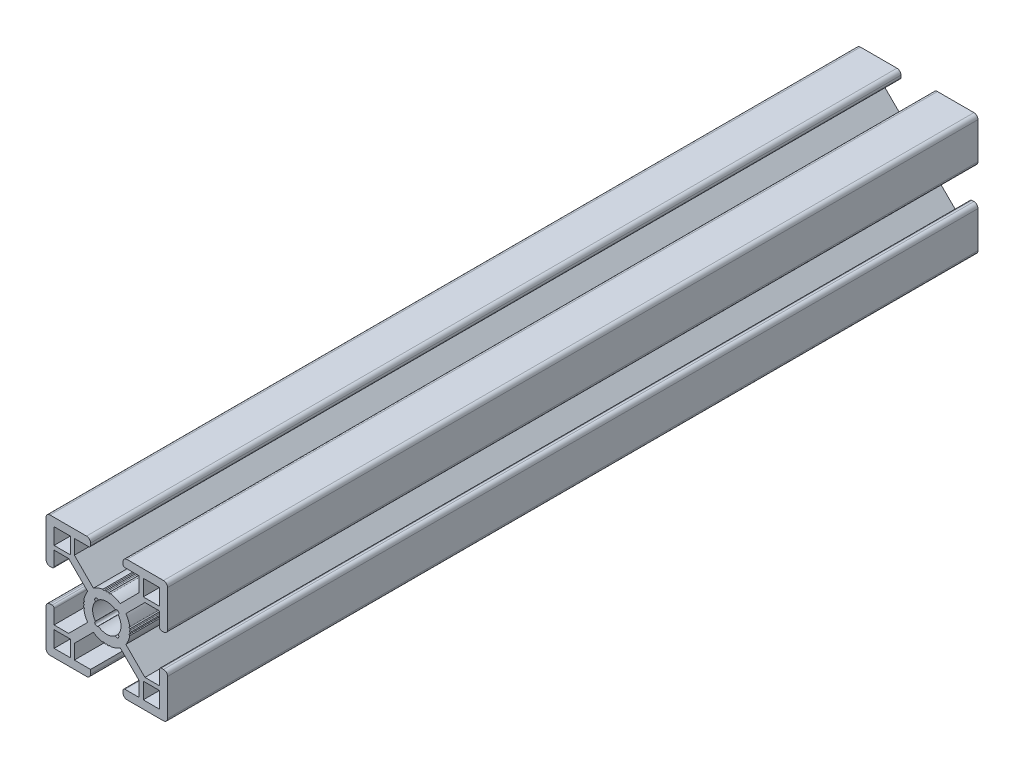
from build123d import *

# Parameters (mm, degrees)
SKETCH1_W           = 4
SKETCH1_H           = 4
BOSS_EXTRUDE1_DEPTH = 100


with BuildPart() as part:
    # Sketch1 → Boss-Extrude1 (new, symmetric)
    with BuildSketch(Plane.XY):
        with BuildLine():
            Line((-15, 14), (-15, 5))
            ThreePointArc((-15, 5), (-14.707106781, 4.292893219), (-14, 4))
            Line((-14, 4), (-13.5, 4))
            ThreePointArc((-13.5, 4), (-13.146446609, 4.146446609), (-13, 4.5))
            Line((-13, 4.5), (-13, 8))
            Line((-13, 8), (-9.414213562, 8))
            Line((-9.414213562, 8), (-4.711011126, 3.296797563))
            ThreePointArc((-4.711011126, 3.296797563), (-5.322383956, 2.17594325), (-5.671345569, 0.947807702))
            ThreePointArc((-5.671345569, 0.947807702), (-5.502585747, 0.723913043), (-5.723511591, 0.551284925))
            ThreePointArc((-5.723511591, 0.551284925), (-5.737706139, 0.375803491), (-5.746521739, 0.199969752))
            ThreePointArc((-5.746521739, 0.199969752), (-5.607354194, 0.140186212), (-5.55, 0))
            ThreePointArc((-5.55, 0), (-5.607354194, -0.140186212), (-5.746521739, -0.199969752))
            ThreePointArc((-5.746521739, -0.199969752), (-5.737706139, -0.375803491), (-5.723511591, -0.551284925))
            ThreePointArc((-5.723511591, -0.551284925), (-5.502585747, -0.723913043), (-5.671345569, -0.947807702))
            ThreePointArc((-5.671345569, -0.947807702), (-5.322383956, -2.17594325), (-4.711011126, -3.296797563))
            Line((-4.711011126, -3.296797563), (-9.414213562, -8))
            Line((-9.414213562, -8), (-13, -8))
            Line((-13, -8), (-13, -4.5))
            ThreePointArc((-13, -4.5), (-13.146446609, -4.146446609), (-13.5, -4))
            Line((-13.5, -4), (-14, -4))
            ThreePointArc((-14, -4), (-14.707106781, -4.292893219), (-15, -5))
            Line((-15, -5), (-15, -14))
            ThreePointArc((-15, -14), (-14.707106781, -14.707106781), (-14, -15))
            Line((-14, -15), (-5, -15))
            ThreePointArc((-5, -15), (-4.292893219, -14.707106781), (-4, -14))
            Line((-4, -14), (-4, -13))
            Line((-4, -13), (-8, -13))
            Line((-8, -13), (-8, -9.414213562))
            Line((-8, -9.414213562), (-3.296797563, -4.711011126))
            ThreePointArc((-3.296797563, -4.711011126), (-2.17594325, -5.322383956), (-0.947807702, -5.671345569))
            ThreePointArc((-0.947807702, -5.671345569), (-0.723913043, -5.502585747), (-0.551284925, -5.723511591))
            ThreePointArc((-0.551284925, -5.723511591), (-0.375803491, -5.737706139), (-0.199969752, -5.746521739))
            ThreePointArc((-0.199969752, -5.746521739), (-0.140186212, -5.607354194), (0, -5.55))
            ThreePointArc((0, -5.55), (0.140186212, -5.607354194), (0.199969752, -5.746521739))
            ThreePointArc((0.199969752, -5.746521739), (0.375803491, -5.737706139), (0.551284925, -5.723511591))
            ThreePointArc((0.551284925, -5.723511591), (0.723913043, -5.502585747), (0.947807702, -5.671345569))
            ThreePointArc((0.947807702, -5.671345569), (2.17594325, -5.322383956), (3.296797563, -4.711011126))
            Line((3.296797563, -4.711011126), (8, -9.414213562))
            Line((8, -9.414213562), (8, -13))
            Line((8, -13), (4.5, -13))
            ThreePointArc((4.5, -13), (4.146446609, -13.146446609), (4, -13.5))
            Line((4, -13.5), (4, -14))
            ThreePointArc((4, -14), (4.292893219, -14.707106781), (5, -15))
            Line((5, -15), (14, -15))
            ThreePointArc((14, -15), (14.707106781, -14.707106781), (15, -14))
            Line((15, -14), (15, -5))
            ThreePointArc((15, -5), (14.707106781, -4.292893219), (14, -4))
            Line((14, -4), (13.5, -4))
            ThreePointArc((13.5, -4), (13.146446609, -4.146446609), (13, -4.5))
            Line((13, -4.5), (13, -8))
            Line((13, -8), (9.414213562, -8))
            Line((9.414213562, -8), (4.711011126, -3.296797563))
            ThreePointArc((4.711011126, -3.296797563), (5.322383956, -2.17594325), (5.671345569, -0.947807702))
            ThreePointArc((5.671345569, -0.947807702), (5.502585747, -0.723913043), (5.723511591, -0.551284925))
            ThreePointArc((5.723511591, -0.551284925), (5.737706139, -0.375803491), (5.746521739, -0.199969752))
            ThreePointArc((5.746521739, -0.199969752), (5.607354194, -0.140186212), (5.55, 0))
            ThreePointArc((5.55, 0), (5.607354194, 0.140186212), (5.746521739, 0.199969752))
            ThreePointArc((5.746521739, 0.199969752), (5.737706139, 0.375803491), (5.723511591, 0.551284925))
            ThreePointArc((5.723511591, 0.551284925), (5.502585747, 0.723913043), (5.671345569, 0.947807702))
            ThreePointArc((5.671345569, 0.947807702), (5.322383956, 2.17594325), (4.711011126, 3.296797563))
            Line((4.711011126, 3.296797563), (9.414213562, 8))
            Line((9.414213562, 8), (13, 8))
            Line((13, 8), (13, 4.5))
            ThreePointArc((13, 4.5), (13.146446609, 4.146446609), (13.5, 4))
            Line((13.5, 4), (14, 4))
            ThreePointArc((14, 4), (14.707106781, 4.292893219), (15, 5))
            Line((15, 5), (15, 14))
            ThreePointArc((15, 14), (14.707106781, 14.707106781), (14, 15))
            Line((14, 15), (5, 15))
            ThreePointArc((5, 15), (4.292893219, 14.707106781), (4, 14))
            Line((4, 14), (4, 13.5))
            ThreePointArc((4, 13.5), (4.146446609, 13.146446609), (4.5, 13))
            Line((4.5, 13), (8, 13))
            Line((8, 13), (8, 9.414213562))
            Line((8, 9.414213562), (3.296797563, 4.711011126))
            ThreePointArc((3.296797563, 4.711011126), (2.17594325, 5.322383956), (0.947807702, 5.671345569))
            ThreePointArc((0.947807702, 5.671345569), (0.723913043, 5.502585747), (0.551284925, 5.723511591))
            ThreePointArc((0.551284925, 5.723511591), (0.375803491, 5.737706139), (0.199969752, 5.746521739))
            ThreePointArc((0.199969752, 5.746521739), (0.140186212, 5.607354194), (0, 5.55))
            ThreePointArc((0, 5.55), (-0.140186212, 5.607354194), (-0.199969752, 5.746521739))
            ThreePointArc((-0.199969752, 5.746521739), (-0.375803491, 5.737706139), (-0.551284925, 5.723511591))
            ThreePointArc((-0.551284925, 5.723511591), (-0.723913043, 5.502585747), (-0.947807702, 5.671345569))
            ThreePointArc((-0.947807702, 5.671345569), (-2.17594325, 5.322383956), (-3.296797563, 4.711011126))
            Line((-3.296797563, 4.711011126), (-8, 9.414213562))
            Line((-8, 9.414213562), (-8, 13))
            Line((-8, 13), (-4.5, 13))
            ThreePointArc((-4.5, 13), (-4.146446609, 13.146446609), (-4, 13.5))
            Line((-4, 13.5), (-4, 14))
            ThreePointArc((-4, 14), (-4.292893219, 14.707106781), (-5, 15))
            Line((-5, 15), (-14, 15))
            ThreePointArc((-14, 15), (-14.707106781, 14.707106781), (-15, 14))
        make_face()
        with Locations((-11, -11)):
            Rectangle(SKETCH1_W, SKETCH1_H, mode=Mode.SUBTRACT)
        with Locations((11, -11)):
            Rectangle(SKETCH1_W, SKETCH1_H, mode=Mode.SUBTRACT)
        with BuildLine():
            ThreePointArc((-2.096969605, 2.802270236), (-1.105000944, 3.320989749), (0, 3.5))
            ThreePointArc((0, 3.5), (1.105000944, 3.320989749), (2.096969605, 2.802270236))
            ThreePointArc((2.096969605, 2.802270236), (2.828427125, 2.828427125), (2.802270236, 2.096969605))
            ThreePointArc((2.802270236, 2.096969605), (3.320989749, 1.105000944), (3.5, 0))
            ThreePointArc((3.5, 0), (3.320989749, -1.105000944), (2.802270236, -2.096969605))
            ThreePointArc((2.802270236, -2.096969605), (2.828427125, -2.828427125), (2.096969605, -2.802270236))
            ThreePointArc((2.096969605, -2.802270236), (1.105000944, -3.320989749), (0, -3.5))
            ThreePointArc((0, -3.5), (-1.105000944, -3.320989749), (-2.096969605, -2.802270236))
            ThreePointArc((-2.096969605, -2.802270236), (-2.828427125, -2.828427125), (-2.802270236, -2.096969605))
            ThreePointArc((-2.802270236, -2.096969605), (-3.320989749, -1.105000944), (-3.5, 0))
            ThreePointArc((-3.5, 0), (-3.320989749, 1.105000944), (-2.802270236, 2.096969605))
            ThreePointArc((-2.802270236, 2.096969605), (-2.828427125, 2.828427125), (-2.096969605, 2.802270236))
        make_face(mode=Mode.SUBTRACT)
        with Locations((-11, 11)):
            Rectangle(SKETCH1_W, SKETCH1_H, mode=Mode.SUBTRACT)
        with Locations((11, 11)):
            Rectangle(SKETCH1_W, SKETCH1_H, mode=Mode.SUBTRACT)
    extrude(amount=BOSS_EXTRUDE1_DEPTH, both=True)


solid = part.part
